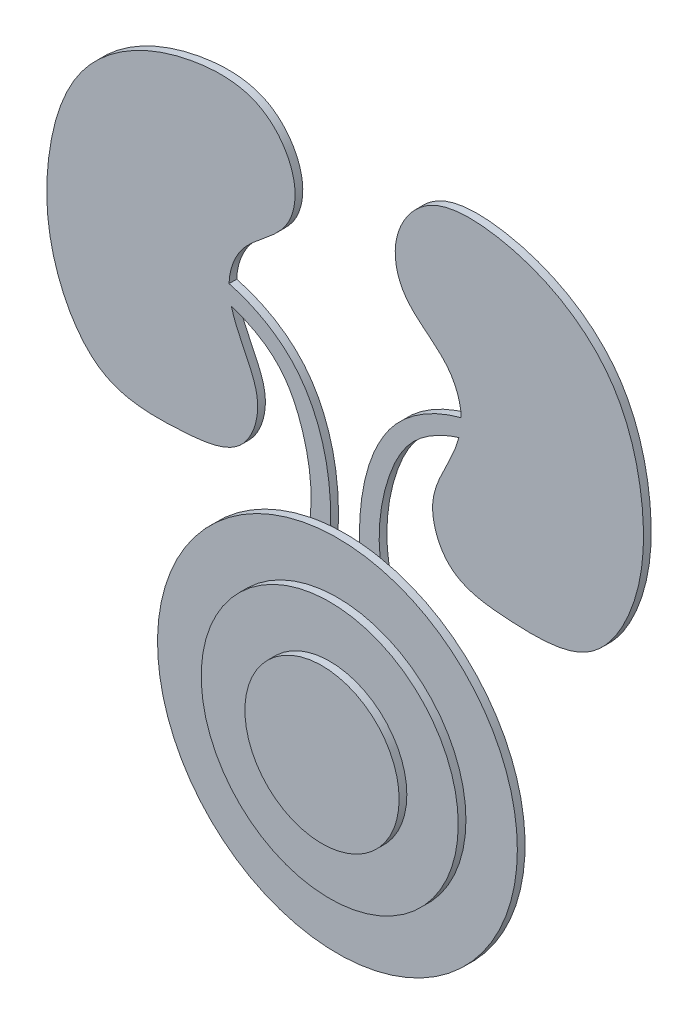
from build123d import *

# Parameters (mm, degrees)
BOSS_EXTRUDE2_DEPTH   = 3
BOSS_EXTRUDE2_2_DEPTH = 3
SKETCH4_R             = 70
BOSS_EXTRUDE3_DEPTH   = 3
SKETCH5_R             = 50
BOSS_EXTRUDE4_DEPTH   = 3
SKETCH6_R             = 30
BOSS_EXTRUDE5_DEPTH   = 3


with BuildPart() as part:
    # Sketch3 → Boss-Extrude2 (new body)
    with BuildSketch(Plane.XY):
        with BuildLine():
            Line((-28.83029104, -28.600867132), (-9.726410368, -28.600867132))
            add(Edge.make_bspline(
                [(-45.169389024, 63.231805303), (-35.574917599, 60.705834404), (-19.203327028, 51.884777116), (-8.51745089, 30.258778623), (-4.064448708, 3.852844659), (-6.622182463, -15.593263391), (-9.726410368, -28.600867132)],
                knots=[0, 0, 0, 0, 0.272897155, 0.476544659, 0.633441314, 1, 1, 1, 1], degree=3))
            add(Edge.make_bspline(
                [(-45.169389024, 63.231805303), (-45.039168446, 68.040363755), (-41.332930576, 78.400419332), (-30.337459437, 85.806682659), (-21.062745894, 95.07114023), (-17.24034738, 111.229787875), (-30.554320793, 132.390797273), (-67.310173393, 133.246136144), (-105.166028049, 112.881554326), (-117.515056312, 70.292497895), (-115.528314454, 35.556653209), (-96.746601788, 3.68766317), (-66.006962233, 3.738210195), (-39.381914286, 6.615936229), (-31.433319045, 28.817243661), (-39.016967159, 43.056355866), (-43.255550925, 52.263426721), (-44.262189479, 56.074336453)],
                knots=[0, 0, 0, 0, 0.039184944, 0.081821681, 0.105864749, 0.144209492, 0.2072355, 0.277955383, 0.419781589, 0.522441227, 0.617976162, 0.703158761, 0.786788828, 0.852004593, 0.901057909, 0.948239721, 0.980255045, 0.980255045, 0.980255045, 0.980255045], degree=3))
            add(Edge.make_bspline(
                [(-44.262189479, 56.074336453), (-37.402830498, 53.942211242), (-24.634464842, 47.168227203), (-16.172324342, 28.979359111), (-10.916734963, 2.773323812), (-16.052498214, -18.642044597), (-28.83029104, -28.600867132)],
                knots=[0, 0, 0, 0, 0.214973471, 0.398290674, 0.567935203, 1, 1, 1, 1], degree=3))
        make_face()
    extrude(amount=-BOSS_EXTRUDE2_DEPTH)



with BuildPart() as body_2:
    # Sketch3 → Boss-Extrude2 2 (new body)
    with BuildSketch(Plane.XY):
        with BuildLine():
            Line((28.83029104, -28.600867132), (9.726410368, -28.600867132))
            add(Edge.make_bspline(
                [(45.169389024, 63.231805303), (35.574917599, 60.705834404), (19.203327028, 51.884777116), (8.51745089, 30.258778623), (4.064448708, 3.852844659), (6.622182463, -15.593263391), (9.726410368, -28.600867132)],
                knots=[0, 0, 0, 0, 0.272897155, 0.476544659, 0.633441314, 1, 1, 1, 1], degree=3))
            add(Edge.make_bspline(
                [(45.169389024, 63.231805303), (45.039168446, 68.040363755), (41.332930576, 78.400419332), (30.337459437, 85.806682659), (21.062745894, 95.07114023), (17.24034738, 111.229787875), (30.554320793, 132.390797273), (67.310173393, 133.246136144), (105.166028049, 112.881554326), (117.515056312, 70.292497895), (115.528314454, 35.556653209), (96.746601788, 3.68766317), (66.006962233, 3.738210195), (39.381914286, 6.615936229), (31.433319045, 28.817243661), (39.016967159, 43.056355866), (43.255550925, 52.263426721), (44.262189479, 56.074336453)],
                knots=[0, 0, 0, 0, 0.039184944, 0.081821681, 0.105864749, 0.144209492, 0.2072355, 0.277955383, 0.419781589, 0.522441227, 0.617976162, 0.703158761, 0.786788828, 0.852004593, 0.901057909, 0.948239721, 0.980255045, 0.980255045, 0.980255045, 0.980255045], degree=3))
            add(Edge.make_bspline(
                [(44.262189479, 56.074336453), (37.402830498, 53.942211242), (24.634464842, 47.168227203), (16.172324342, 28.979359111), (10.916734963, 2.773323812), (16.052498214, -18.642044597), (28.83029104, -28.600867132)],
                knots=[0, 0, 0, 0, 0.214973471, 0.398290674, 0.567935203, 1, 1, 1, 1], degree=3))
        make_face()
    extrude(amount=-BOSS_EXTRUDE2_2_DEPTH)


with BuildPart() as part_1:
    add(part.part)

    add(body_2.part)  # Boss-Extrude3 merges body 2
    # Sketch4 → Boss-Extrude3 (add)
    with BuildSketch(Plane.XY):
        with Locations(Location((0, -68.392688112, 0), (0, 0, 101.193973189))):
            Circle(SKETCH4_R)
    extrude(amount=BOSS_EXTRUDE3_DEPTH)

    # Sketch5 → Boss-Extrude4 (add)
    with BuildSketch(Plane.XY.offset(3)):
        with Locations((0, -68.392688112)):
            Circle(SKETCH5_R)
    extrude(amount=BOSS_EXTRUDE4_DEPTH)

    # Sketch6 → Boss-Extrude5 (add)
    with BuildSketch(Plane.XY.offset(6)):
        with Locations((0, -68.392688112)):
            Circle(SKETCH6_R)
    extrude(amount=BOSS_EXTRUDE5_DEPTH)


solid = part_1.part
